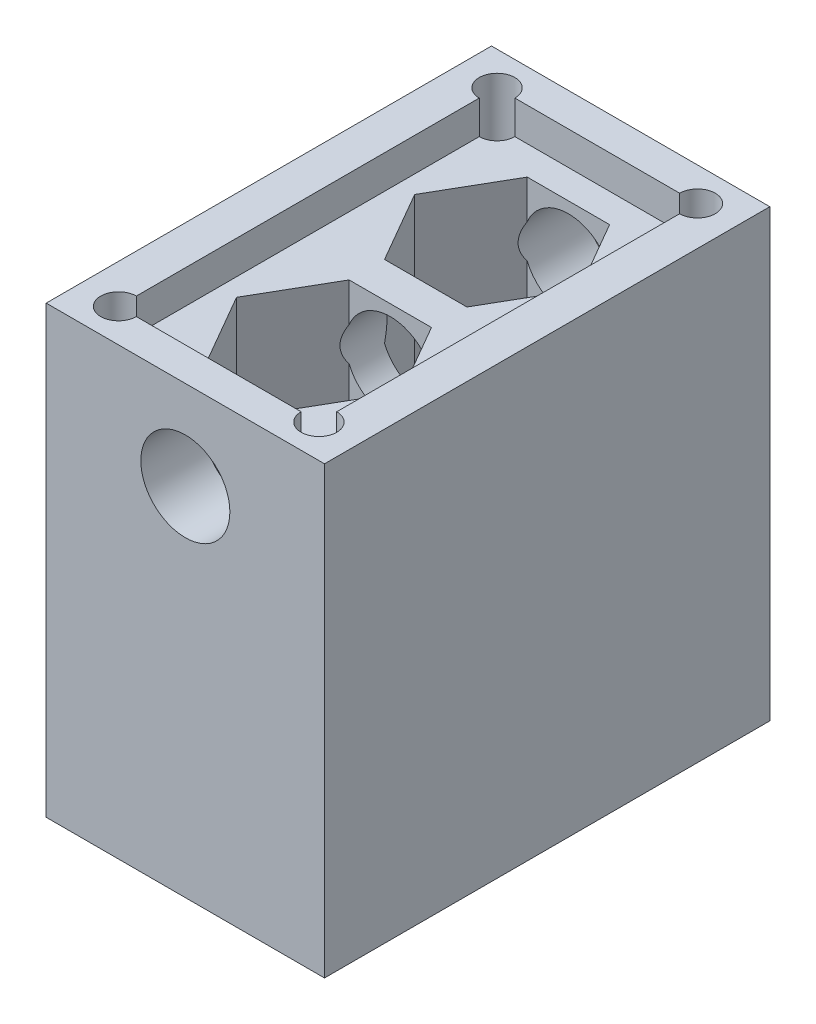
from build123d import *

# Parameters (mm, degrees)
SKETCH1_W           = 25
SKETCH1_H           = 40
BOSS_EXTRUDE1_DEPTH = 40
SKETCH2_R           = 4
CUT_EXTRUDE1_DEPTH  = 58.933151131
SKETCH4_R           = 4.15
CUT_EXTRUDE2_DEPTH  = 47.435439053
CUT_EXTRUDE3_DEPTH  = 18
SKETCH6_R           = 1.6
CUT_EXTRUDE4_DEPTH  = 47.435439053
SKETCH7_W           = 18
SKETCH7_H           = 34
CUT_EXTRUDE5_DEPTH  = 3


with BuildPart() as part:
    # Sketch1 → Boss-Extrude1 (new body)
    with BuildSketch(Plane(origin=(0, 0, 0), x_dir=(1, 0, 0), z_dir=(0, 1, 0))):
        Rectangle(SKETCH1_W, SKETCH1_H)
    extrude(amount=BOSS_EXTRUDE1_DEPTH)

    # Sketch2 → Cut-Extrude1 (cut, through all)
    with BuildSketch(Plane.XY.offset(20)):
        with Locations((0, 32)):
            Circle(SKETCH2_R)
    extrude(amount=-CUT_EXTRUDE1_DEPTH, mode=Mode.SUBTRACT)

    # Sketch4 → Cut-Extrude2 (cut, through all)
    with BuildSketch(Plane(origin=(0, 40, 0), x_dir=(1, 0, 0), z_dir=(0, 1, 0))):
        with Locations(Location((0, -8, 0), (0, 0, 270))):
            Circle(SKETCH4_R)
        with Locations(Location((0, 8, 0), (0, 0, 270))):
            Circle(SKETCH4_R)
    extrude(amount=-CUT_EXTRUDE2_DEPTH, mode=Mode.SUBTRACT)

    # Sketch5 → Cut-Extrude3 (cut)
    with BuildSketch(Plane(origin=(0, 40, 0), x_dir=(1, 0, 0), z_dir=(0, 1, 0))):
        Polygon((-3.7, -14.408587988), (3.7, -14.408587988), (7.4, -8), (3.7, -1.591412012), (-3.7, -1.591412012), (-7.4, -8), align=None)
        Polygon((-3.7, 14.408587988), (-7.4, 8), (-3.7, 1.591412012), (3.7, 1.591412012), (7.4, 8), (3.7, 14.408587988), align=None)
    extrude(amount=-CUT_EXTRUDE3_DEPTH, mode=Mode.SUBTRACT)

    # Sketch6 → Cut-Extrude4 (cut, through all)
    with BuildSketch(Plane(origin=(0, 40, 0), x_dir=(1, 0, 0), z_dir=(0, 1, 0))):
        with Locations(Location((9, -17, 0), (0, 0, 270))):
            Circle(SKETCH6_R)
        with Locations(Location((-9, -17, 0), (0, 0, 270))):
            Circle(SKETCH6_R)
        with Locations(Location((-9, 17, 0), (0, 0, 270))):
            Circle(SKETCH6_R)
        with Locations(Location((9, 17, 0), (0, 0, 270))):
            Circle(SKETCH6_R)
    extrude(amount=-CUT_EXTRUDE4_DEPTH, mode=Mode.SUBTRACT)

    # Sketch7 → Cut-Extrude5 (cut)
    with BuildSketch(Plane(origin=(0, 40, 0), x_dir=(1, 0, 0), z_dir=(0, 1, 0))):
        Rectangle(SKETCH7_W, SKETCH7_H)
    extrude(amount=-CUT_EXTRUDE5_DEPTH, mode=Mode.SUBTRACT)


solid = part.part
